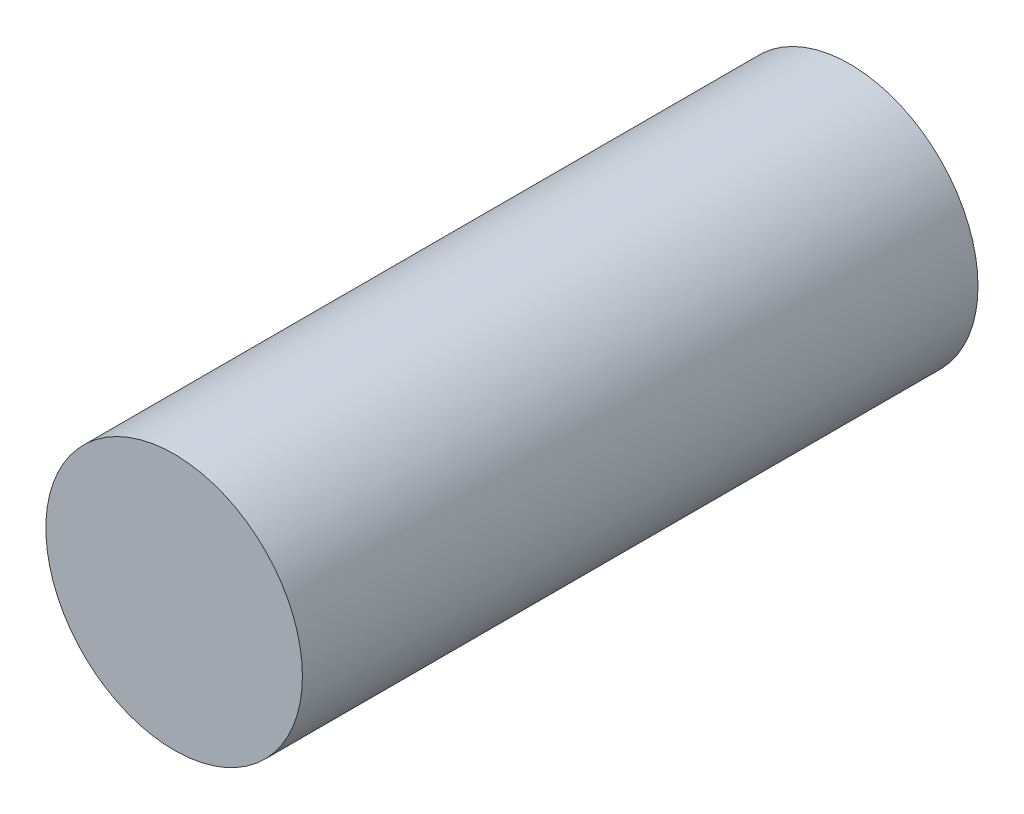
from build123d import *

# Parameters (mm, degrees)
SKETCH1_R           = 1.5
BOSS_EXTRUDE1_DEPTH = 7.9


with BuildPart() as part:
    # Sketch1 → Boss-Extrude1 (new body)
    with BuildSketch(Plane.XY):
        Circle(SKETCH1_R)
    extrude(amount=BOSS_EXTRUDE1_DEPTH)


solid = part.part
